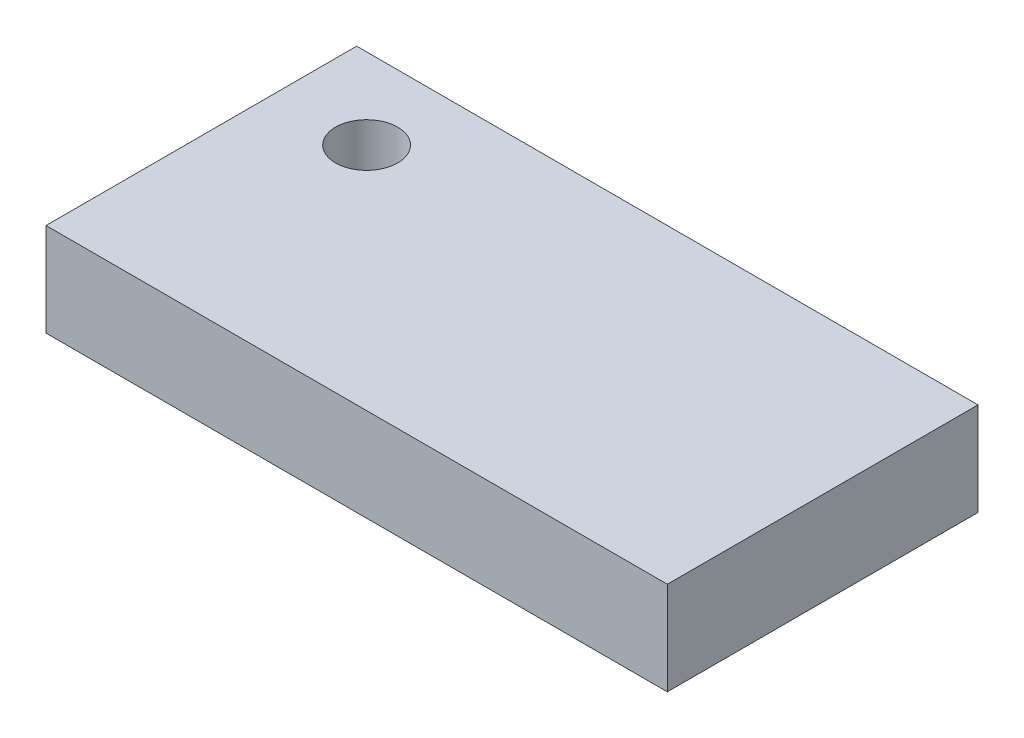
from build123d import *

# Parameters (mm, degrees)
SKETCH1_W           = 100
SKETCH1_H           = 50
BOSS_EXTRUDE1_DEPTH = 15
SKETCH2_R           = 5
CUT_EXTRUDE1_DEPTH  = 10


with BuildPart() as part:
    # Sketch1 → Boss-Extrude1 (new body)
    with BuildSketch(Plane(origin=(0, 0, 0), x_dir=(1, 0, 0), z_dir=(0, 1, 0))):
        with Locations((0, 8.665644172)):
            Rectangle(SKETCH1_W, SKETCH1_H)
    extrude(amount=BOSS_EXTRUDE1_DEPTH)

    # Sketch2 → Cut-Extrude1 (cut)
    with BuildSketch(Plane(origin=(0, 15, 0), x_dir=(1, 0, 0), z_dir=(0, 1, 0))):
        with Locations(Location((-35.417207638, 20.680861356, 0), (0, 0, 270))):
            Circle(SKETCH2_R)
    extrude(amount=-CUT_EXTRUDE1_DEPTH, mode=Mode.SUBTRACT)


solid = part.part
